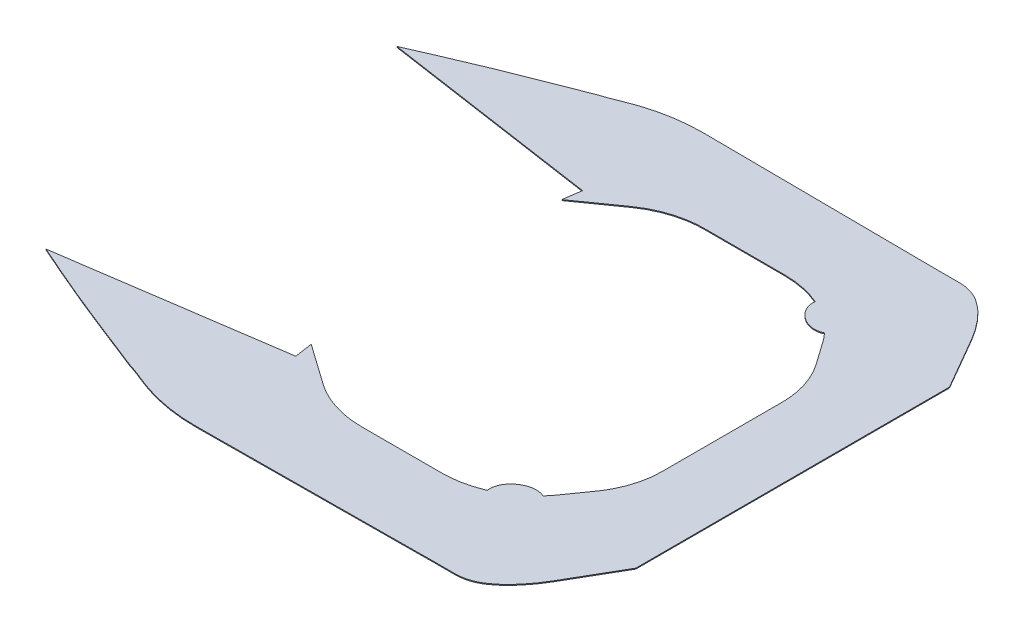
from build123d import *

# Parameters (mm, degrees)
EXTRUDE_1_DEPTH = 0.1


with BuildPart() as part:
    # 草图1 → 凸台-拉伸1 (new body)
    with BuildSketch(Plane(origin=(0, -10.949084909, 0), x_dir=(1, 0, 0), z_dir=(0, 1, 0))):
        with BuildLine():
            Line((-67.045080203, -117.983786499), (-76.078205458, -117.983786499))
            add(Edge.make_bspline(
                [(-82.366927771, -116.005961919), (-79.563852737, -117.983786499), (-76.078205458, -117.983786499)],
                knots=[4.075890496, 4.075890496, 4.075890496, 4.712399313, 4.712399313, 4.712399313], degree=2, weights=[1, 0.949783076, 1]))
            Line((-82.366927771, -116.005961919), (-86.967943677, -112.759526398))
            Line((-86.967943677, -112.759526398), (-86.66702356, -114.807769687))
            Line((-86.66702356, -114.807769687), (-111.241670212, -118.425801057))
            Line((-111.241670212, -118.425801057), (-108.0966731, -119.800840581))
            add(Edge.make_bspline(
                [(-108.0966731, -119.800840581), (-105.971797962, -120.729867602), (-103.827924135, -121.613160044), (-100.595217951, -122.897424713), (-99.515004816, -123.318774975), (-97.353838597, -124.159590102), (-96.272482279, -124.578027529), (-95.196799494, -125.010921142)],
                knots=[0, 0, 0, 0, 0.5, 0.5, 0.75, 0.75, 1, 1, 1, 1], degree=3))
            ThreePointArc((-95.196799494, -125.010921142), (-94.249756822, -125.33125391), (-93.31982615, -125.698312286))
            ThreePointArc((-93.31982615, -125.698312286), (-89.442183041, -126.892625888), (-85.402949621, -127.276154819))
            Line((-85.402949621, -127.276154819), (-58.781187755, -127.079371035))
            Line((-58.781187755, -127.079371035), (-56.430656299, -127.079369812))
            ThreePointArc((-56.430656299, -127.079369812), (-55.112439193, -126.899899352), (-53.890746331, -126.373237664))
            ThreePointArc((-53.890746331, -126.373237664), (-53.196333096, -125.865073255), (-52.53246977, -125.317600615))
            ThreePointArc((-52.53246977, -125.317600615), (-51.259593224, -123.863558054), (-50.185329276, -122.257192143))
            Line((-50.185329276, -122.257192143), (-46.750975764, -116.322993851))
            Line((-46.750975764, -116.322993851), (-46.75062646, -80.91004751))
            Line((-46.75062646, -80.91004751), (-50.184862905, -74.975781469))
            ThreePointArc((-50.184862905, -74.975781469), (-51.259095163, -73.369394365), (-52.531943024, -71.915326694))
            ThreePointArc((-52.531943024, -71.915326694), (-53.19579555, -71.367840957), (-53.89019876, -70.859662849))
            ThreePointArc((-53.89019876, -70.859662849), (-55.111881232, -70.33297706), (-56.430094797, -70.153480595))
            Line((-56.430094797, -70.153480595), (-58.780626253, -70.153433003))
            Line((-58.780626253, -70.153433003), (-85.402384232, -69.956124039))
            ThreePointArc((-85.402384232, -69.956124039), (-89.441625217, -70.339573285), (-93.319291886, -71.533810391))
            ThreePointArc((-93.319291886, -71.533810391), (-94.249229798, -71.900850422), (-95.19627879, -72.221164507))
            add(Edge.make_bspline(
                [(-95.19627879, -72.221164507), (-96.271970115, -72.6540369), (-97.353334687, -73.072452994), (-99.514517493, -73.913225487), (-100.59473894, -74.334554439), (-103.827470458, -75.618755334), (-105.97136171, -76.502005483), (-108.096255175, -77.430990586)],
                knots=[0, 0, 0, 0, 0.25, 0.25, 0.5, 0.5, 1, 1, 1, 1], degree=3))
            Line((-108.096255175, -77.430990586), (-111.241279412, -78.805968066))
            Line((-111.241279412, -78.805968066), (-86.66670414, -82.424484231))
            Line((-86.66670414, -82.424484231), (-86.967664664, -84.472721583))
            Line((-86.967664664, -84.472721583), (-82.366584714, -81.22637683))
            add(Edge.make_bspline(
                [(-76.077823385, -79.24867631), (-79.563470664, -79.248607547), (-82.366584714, -81.22637683)],
                knots=[1.570785994, 1.570785994, 1.570785994, 2.207294811, 2.207294811, 2.207294811], degree=2, weights=[1, 0.949783076, 1]))
            Line((-76.077823385, -79.24867631), (-67.044698132, -79.248854511))
            add(Edge.make_bspline(
                [(-62.683601233, -80.146897051), (-64.762697974, -79.248899529), (-67.044698132, -79.248854511)],
                knots=[1.145918634, 1.145918634, 1.145918634, 1.570785994, 1.570785994, 1.570785994], degree=2, weights=[1, 0.977520694, 1]))
            add(Edge.make_bspline(
                [(-62.683601233, -80.146897051), (-62.894449532, -81.896256877), (-60.687964501, -83.473316782), (-59.102374608, -82.676422485)],
                knots=[0, 0, 0, 0, 1, 1, 1, 1], degree=3))
            add(Edge.make_bspline(
                [(-58.26969245, -83.706560633), (-58.651206281, -83.165836905), (-59.102374608, -82.676422485)],
                knots=[0.592759072, 0.592759072, 0.592759072, 0.721677091, 0.721677091, 0.721677091], degree=2, weights=[1, 0.997923237, 1]))
            Line((-58.26969245, -83.706560633), (-56.516625716, -86.191201302))
            add(Edge.make_bspline(
                [(-54.711742979, -91.83369464), (-54.711682133, -88.749367598), (-56.516625716, -86.191201302)],
                knots=[6.283175891, 6.283175891, 6.283175891, 6.87594438, 6.87594438, 6.87594438], degree=2, weights=[1, 0.956398771, 1]))
            Line((-54.711742979, -91.83369464), (-54.711876785, -98.616442891))
            Line((-54.711876785, -98.616442891), (-54.711876785, -105.39918967))
            add(Edge.make_bspline(
                [(-56.516870834, -111.041647402), (-54.711876785, -108.483516713), (-54.711876785, -105.39918967)],
                knots=[2.548833581, 2.548833581, 2.548833581, 3.14160207, 3.14160207, 3.14160207], degree=2, weights=[1, 0.956398771, 1]))
            Line((-56.516870834, -111.041647402), (-58.269986584, -113.526253487))
            add(Edge.make_bspline(
                [(-59.057260101, -114.506771823), (-58.63215538, -114.039537789), (-58.269986584, -113.526253487)],
                knots=[2.426439148, 2.426439148, 2.426439148, 2.548833581, 2.548833581, 2.548833581], degree=2, weights=[1, 0.998128035, 1]))
            add(Edge.make_bspline(
                [(-59.057260101, -114.506771823), (-60.673260847, -113.714088204), (-63.015981908, -115.243372449), (-62.745885648, -117.112344827)],
                knots=[0, 0, 0, 0, 1, 1, 1, 1], degree=3))
            add(Edge.make_bspline(
                [(-67.045080203, -117.983786499), (-64.798566381, -117.983786499), (-62.745885648, -117.112344827)],
                knots=[1.570806659, 1.570806659, 1.570806659, 1.989259675, 1.989259675, 1.989259675], degree=2, weights=[1, 0.978191864, 1]))
        make_face()
    extrude(amount=EXTRUDE_1_DEPTH)


solid = part.part
